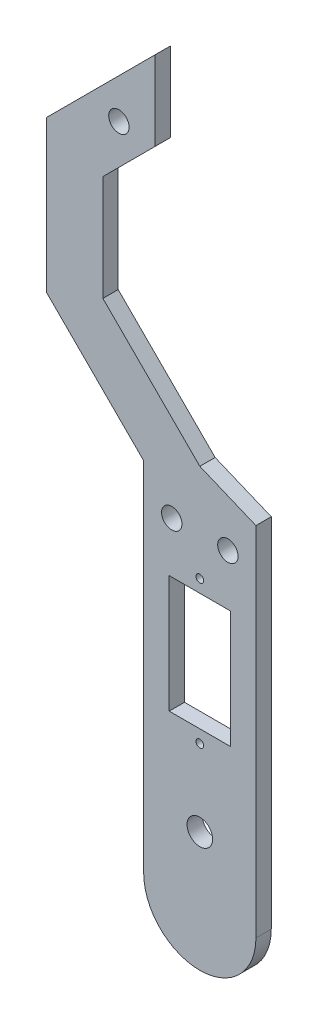
from build123d import *

# Parameters (mm, degrees)
SALIENTE_EXTRUIR1_DEPTH    = 3
CORTAR_EXTRUIR1_DEPTH      = 142.749779541
CORTAR_EXTRUIR1_DEPTH_BACK = 11
CROQUIS1_4_R               = 2
CROQUIS1_5_R               = 2
CORTAR_EXTRUIR3_DEPTH      = 142.749779541
CROQUIS1_6_W               = 12
CROQUIS1_6_H               = 23
TAMA_O_DEL_SERVO_DEPTH     = 142.749779541
CROQUIS1_7_R               = 0.75
CORTAR_EXTRUIR4_DEPTH      = 142.749779541
CROQUIS1_8_R               = 0.75
CORTAR_EXTRUIR5_DEPTH      = 142.749779541
CROQUIS1_11_R              = 2.5
CORTAR_EXTRUIR8_DEPTH      = 142.749779541


with BuildPart() as part:
    # Croquis1 → Saliente-Extruir1 (new body)
    with BuildSketch(Plane.XY):
        with BuildLine():
            Line((22, 0), (22, 70))
            Line((22, 70), (11, 74.556349186))
            Line((11, 74.556349186), (-8, 93.556349186))
            Line((-8, 93.556349186), (-8, 114.230447378))
            Line((-8, 114.230447378), (2.213203436, 124.443650814))
            Line((2.213203436, 124.443650814), (2.213203436, 140))
            Line((2.213203436, 140), (-19, 118.786796564))
            Line((-19, 118.786796564), (-19, 89))
            Line((-19, 89), (0, 70))
            Line((0, 70), (0, 0))
            ThreePointArc((0, 0), (11, -11), (22, 0))
        make_face()
    extrude(amount=SALIENTE_EXTRUIR1_DEPTH)

    # Croquis1<4> → Cortar-Extruir1 (cut, two sides: drawn at the far end of the back side and taken through both)
    with BuildSketch(Plane.XY.offset(-CORTAR_EXTRUIR1_DEPTH_BACK)):
        with Locations((5.5, 63)):
            Circle(CROQUIS1_4_R)
        with Locations((16.5, 63)):
            Circle(CROQUIS1_4_R)
    extrude(amount=CORTAR_EXTRUIR1_DEPTH + CORTAR_EXTRUIR1_DEPTH_BACK, mode=Mode.SUBTRACT)

    # Croquis1<5> → Cortar-Extruir3 (cut, through all)
    with BuildSketch(Plane.XY):
        with Locations((-4.857864376, 125.150757595)):
            Circle(CROQUIS1_5_R)
    extrude(amount=CORTAR_EXTRUIR3_DEPTH, mode=Mode.SUBTRACT)

    # Croquis1<6> → TAMAÑO DEL SERVO (cut, through all)
    with BuildSketch(Plane.XY):
        with Locations((11, 41.5)):
            Rectangle(CROQUIS1_6_W, CROQUIS1_6_H)
    extrude(amount=TAMA_O_DEL_SERVO_DEPTH, mode=Mode.SUBTRACT)

    # Croquis1<7> → Cortar-Extruir4 (cut, through all)
    with BuildSketch(Plane.XY):
        with Locations((11, 55.5)):
            Circle(CROQUIS1_7_R)
    extrude(amount=CORTAR_EXTRUIR4_DEPTH, mode=Mode.SUBTRACT)

    # Croquis1<8> → Cortar-Extruir5 (cut, through all)
    with BuildSketch(Plane.XY):
        with Locations((11, 27.5)):
            Circle(CROQUIS1_8_R)
    extrude(amount=CORTAR_EXTRUIR5_DEPTH, mode=Mode.SUBTRACT)

    # Croquis1<11> → Cortar-Extruir8 (cut, through all)
    with BuildSketch(Plane.XY):
        with Locations((11, 12.5)):
            Circle(CROQUIS1_11_R)
    extrude(amount=CORTAR_EXTRUIR8_DEPTH, mode=Mode.SUBTRACT)


solid = part.part
